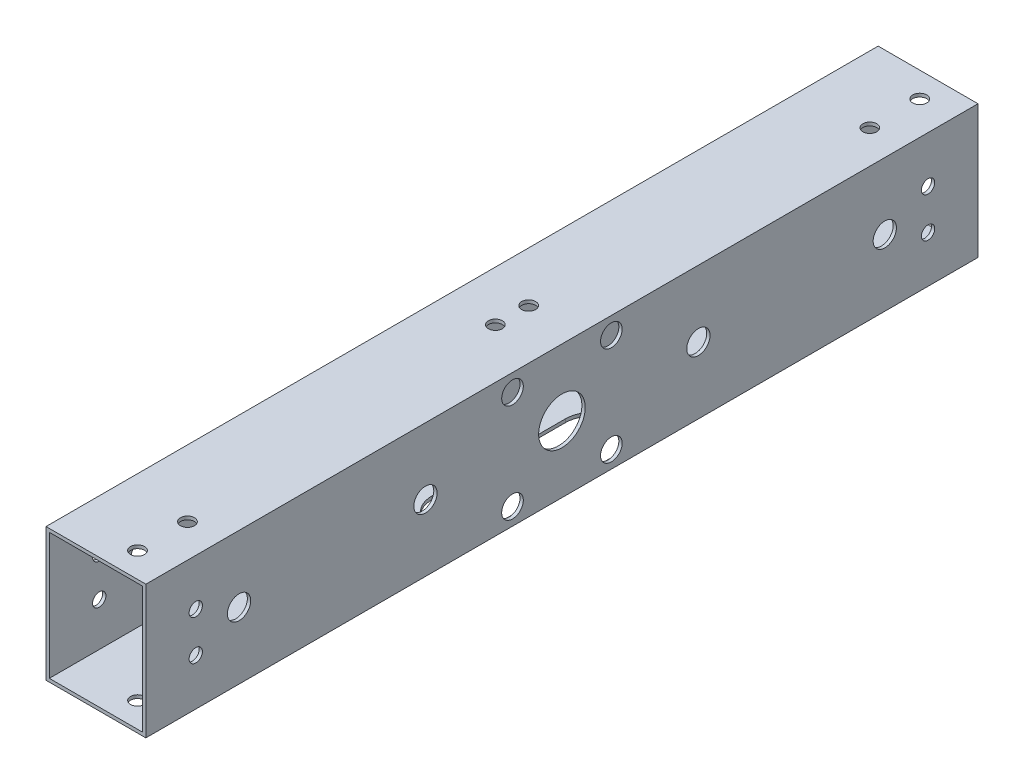
from build123d import *

# Parameters (mm, degrees)
SKETCH_1_W          = 30
SKETCH_1_H          = 40
SKETCH_1_W_2        = 28
SKETCH_1_H_2        = 38
EXTRUDE_1_DEPTH     = 250
SKETCH_3_R          = 2.1
CUT_EXTRUDE_1_DEPTH = 250
SKETCH_4_R          = 3.5
CUT_EXTRUDE_2_DEPTH = 250
SKETCH_5_R          = 7
CUT_EXTRUDE_3_DEPTH = 250
CUT_EXTRUDE_4_DEPTH = 20
CUT_EXTRUDE_START   = -20
SKETCH_8_R          = 3.25
CUT_EXTRUDE_7_DEPTH = 22
SKETCH_9_R          = 2
CUT_EXTRUDE_8_DEPTH = 36


with BuildPart() as part:
    # 草图1 → 凸台-拉伸1 (new body)
    with BuildSketch(Plane.XY):
        Rectangle(SKETCH_1_W, SKETCH_1_H)
        Rectangle(SKETCH_1_W_2, SKETCH_1_H_2, mode=Mode.SUBTRACT)
    extrude(amount=EXTRUDE_1_DEPTH)

    # 草图3 → 切除-拉伸1 (cut)
    with BuildSketch(Plane(origin=(0, 20, 0), x_dir=(1, 0, 0), z_dir=(0, 1, 0))):
        with Locations(Location((5, -7.5, 0), (0, 0, 270))):
            Circle(SKETCH_3_R)
        with Locations(Location((5, -22.5, 0), (0, 0, 270))):
            Circle(SKETCH_3_R)
        with Locations(Location((5, -227.5, 0), (0, 0, 90))):
            Circle(SKETCH_3_R)
        with Locations(Location((5, -242.5, 0), (0, 0, 90))):
            Circle(SKETCH_3_R)
        with Locations(Location((0, -120, 0), (0, 0, 270))):
            Circle(SKETCH_3_R)
        with Locations(Location((0, -130, 0), (0, 0, 90))):
            Circle(SKETCH_3_R)
    extrude(amount=-CUT_EXTRUDE_1_DEPTH, mode=Mode.SUBTRACT)

    # 草图4 → 切除-拉伸2 (cut)
    with BuildSketch(Plane(origin=(15, 0, 0), x_dir=(0, 0, -1), z_dir=(1, 0, 0))):
        with Locations((-222, 0)):
            Circle(SKETCH_4_R)
        with Locations((-166, 0)):
            Circle(SKETCH_4_R)
        with Locations((-84, 0)):
            Circle(SKETCH_4_R)
        with Locations((-28, 0)):
            Circle(SKETCH_4_R)
    extrude(amount=-CUT_EXTRUDE_2_DEPTH, mode=Mode.SUBTRACT)

    # 草图5 → 切除-拉伸3 (cut)
    with BuildSketch(Plane.ZY.offset(15)):
        with Locations((125, 0)):
            Circle(SKETCH_5_R)
    extrude(amount=-CUT_EXTRUDE_3_DEPTH, mode=Mode.SUBTRACT)

    # 草图6 → 切除-拉伸4 (cut)
    with BuildSketch(Plane.XZ.offset(20)):
        with BuildLine():
            Line((-4, 145), (-4, 105))
            ThreePointArc((-4, 105), (4.5, 96.5), (13, 105))
            Line((13, 105), (13, 145))
            ThreePointArc((13, 145), (4.5, 153.5), (-4, 145))
        make_face()
    extrude(amount=-CUT_EXTRUDE_4_DEPTH, mode=Mode.SUBTRACT)

    # 草图8 → 切除-拉伸7 (cut)
    with BuildSketch(Plane.ZY.offset(15).offset(CUT_EXTRUDE_START)):
        with Locations((110.150757595, -14.849242405)):
            Circle(SKETCH_8_R)
        with Locations((139.849242405, -14.849242405)):
            Circle(SKETCH_8_R)
        with Locations((110.150757595, 14.849242405)):
            Circle(SKETCH_8_R)
        with Locations((139.849242405, 14.849242405)):
            Circle(SKETCH_8_R)
    extrude(amount=-CUT_EXTRUDE_7_DEPTH, mode=Mode.SUBTRACT)

    # 草图9 → 切除-拉伸8 (cut)
    with BuildSketch(Plane(origin=(15, 0, 0), x_dir=(0, 0, -1), z_dir=(1, 0, 0))):
        with Locations((-15, 6)):
            Circle(SKETCH_9_R)
        with Locations((-15, -6)):
            Circle(SKETCH_9_R)
        with Locations((-235, -6)):
            Circle(SKETCH_9_R)
        with Locations((-235, 6)):
            Circle(SKETCH_9_R)
    extrude(amount=-CUT_EXTRUDE_8_DEPTH, mode=Mode.SUBTRACT)


solid = part.part
